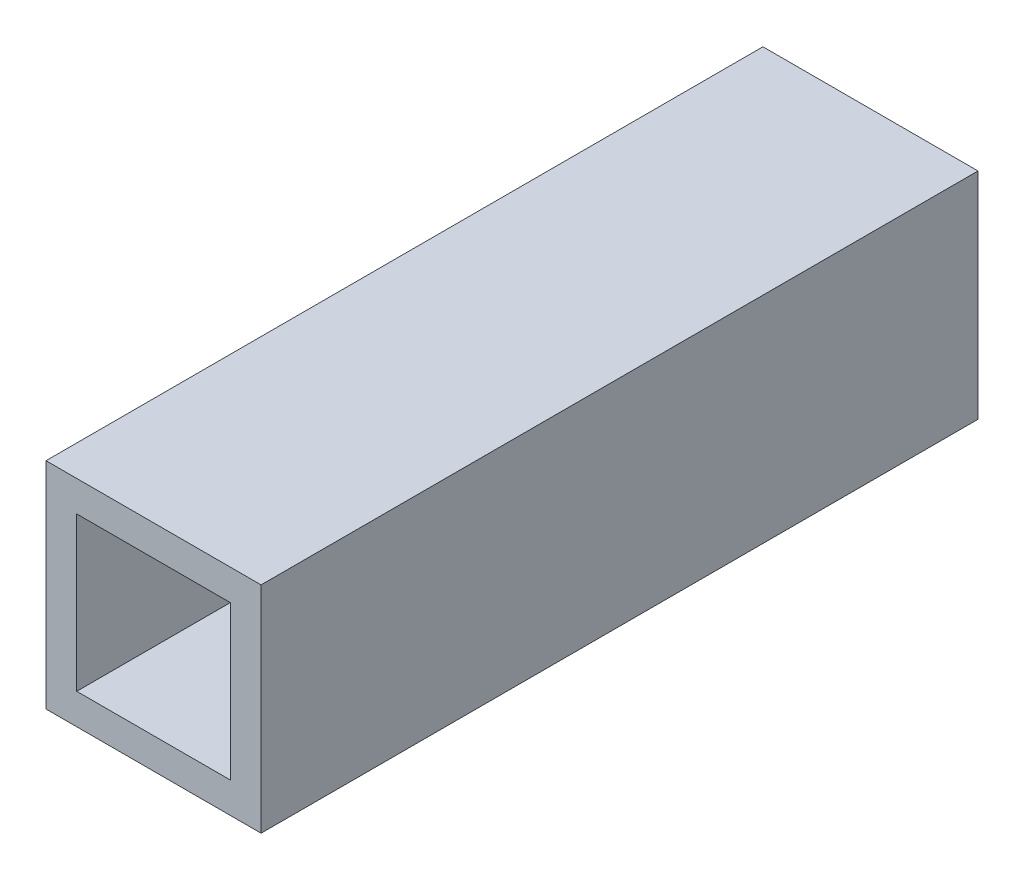
from build123d import *

# Parameters (mm, degrees)
CROQUIS1_W              = 21
CROQUIS1_H              = 21
CROQUIS1_W_2            = 15
CROQUIS1_H_2            = 15
SALIENTE_EXTRUIR1_DEPTH = 70


with BuildPart() as part:
    # Croquis1 → Saliente-Extruir1 (new body)
    with BuildSketch(Plane.XY):
        Rectangle(CROQUIS1_W, CROQUIS1_H)
        Rectangle(CROQUIS1_W_2, CROQUIS1_H_2, mode=Mode.SUBTRACT)
    extrude(amount=SALIENTE_EXTRUIR1_DEPTH)


solid = part.part
